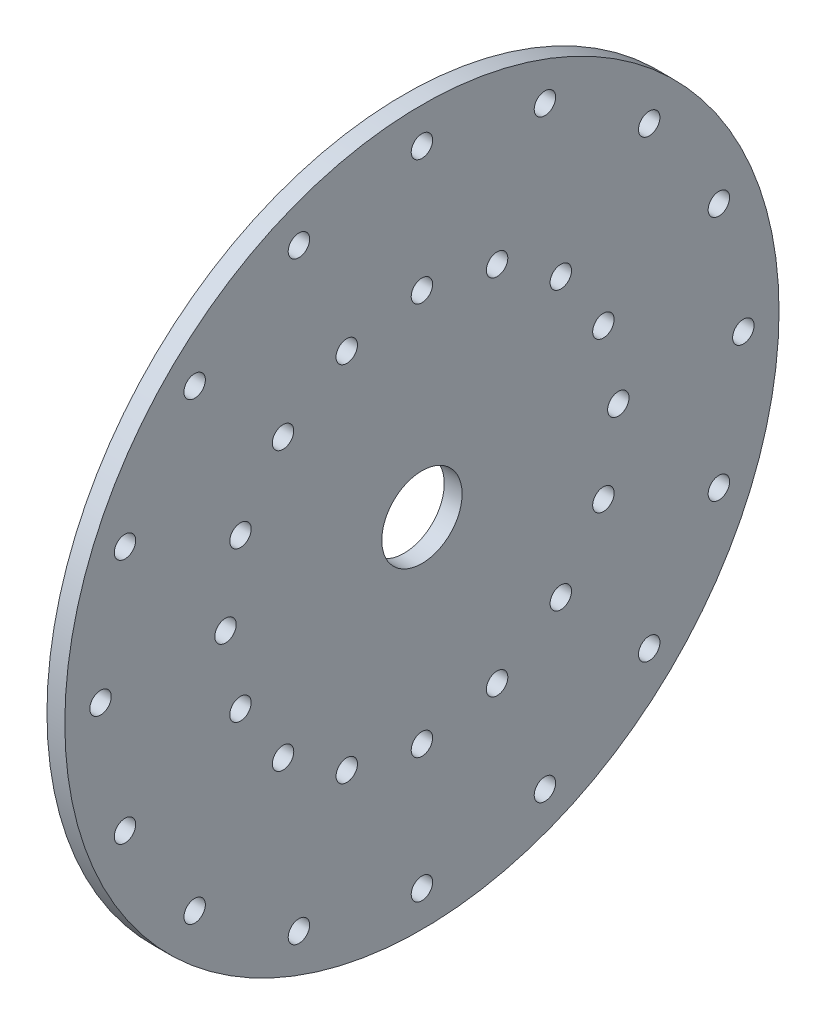
from build123d import *

# Parameters (mm, degrees)
SKETCH1_R           = 200
BOSS_EXTRUDE1_DEPTH = 10
SKETCH2_R           = 22.5
CUT_EXTRUDE1_DEPTH  = 10
SKETCH3_R           = 6
CUT_EXTRUDE2_DEPTH  = 10
CIRPATTERN1_COUNT   = 16
SKETCH4_R           = 6
CUT_EXTRUDE3_DEPTH  = 10
CIRPATTERN2_COUNT   = 16


with BuildPart() as part:
    # Sketch1 → Boss-Extrude1 (new body)
    with BuildSketch(Plane(origin=(0, 0, 0), x_dir=(0, 0, -1), z_dir=(1, 0, 0))):
        Circle(SKETCH1_R)
    extrude(amount=BOSS_EXTRUDE1_DEPTH)

    # Sketch2 → Cut-Extrude1 (cut)
    with BuildSketch(Plane(origin=(10, 0, 0), x_dir=(0, 0, -1), z_dir=(1, 0, 0))):
        Circle(SKETCH2_R)
    extrude(amount=-CUT_EXTRUDE1_DEPTH, mode=Mode.SUBTRACT)

    # Sketch3 → Cut-Extrude2 (cut)
    with BuildSketch(Plane(origin=(10, 0, 0), x_dir=(0, 0, -1), z_dir=(1, 0, 0))):
        with Locations((110, 0)):
            Circle(SKETCH3_R)
    cut_extrude2 = extrude(amount=-CUT_EXTRUDE2_DEPTH, mode=Mode.SUBTRACT)

    # CirPattern1: Cut-Extrude2 ×16 about axis
    cirpattern1_axis = Axis((0, 0, 0), (1, 0, 0))
    for i in range(1, CIRPATTERN1_COUNT):
        add(cut_extrude2.rotate(cirpattern1_axis, i * 360 / CIRPATTERN1_COUNT), mode=Mode.SUBTRACT)

    # Sketch4 → Cut-Extrude3 (cut)
    with BuildSketch(Plane(origin=(10, 0, 0), x_dir=(0, 0, -1), z_dir=(1, 0, 0))):
        with Locations((180, 0)):
            Circle(SKETCH4_R)
    cut_extrude3 = extrude(amount=-CUT_EXTRUDE3_DEPTH, mode=Mode.SUBTRACT)

    # CirPattern2: Cut-Extrude3 ×16 about axis
    cirpattern2_axis = Axis((0, 0, 0), (1, 0, 0))
    for i in range(1, CIRPATTERN2_COUNT):
        add(cut_extrude3.rotate(cirpattern2_axis, i * 360 / CIRPATTERN2_COUNT), mode=Mode.SUBTRACT)


solid = part.part
